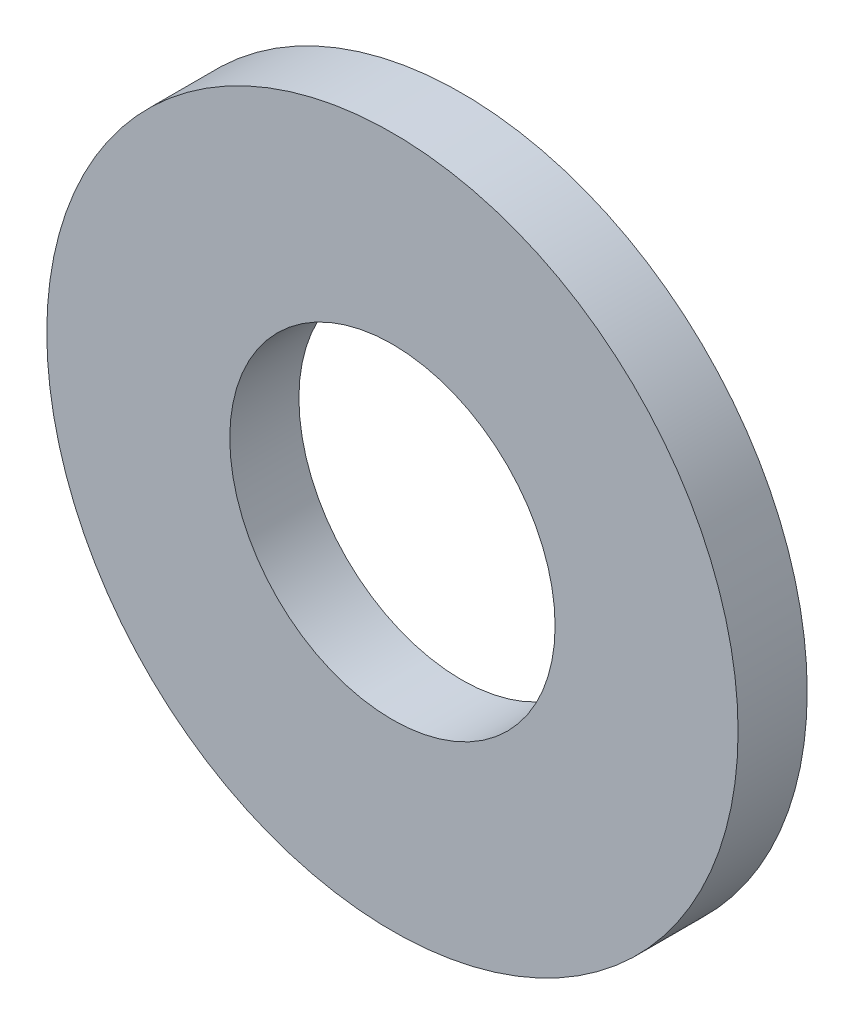
from build123d import *

# Parameters (mm, degrees)
SKETCH_1_R      = 8.5
SKETCH_1_R_2    = 4
EXTRUDE_1_DEPTH = 1.7


with BuildPart() as part:
    # Эскиз1 → Бобышка-Вытянуть1 (new body)
    with BuildSketch(Plane.XY):
        Circle(SKETCH_1_R)
        Circle(SKETCH_1_R_2, mode=Mode.SUBTRACT)
    extrude(amount=EXTRUDE_1_DEPTH)


solid = part.part
